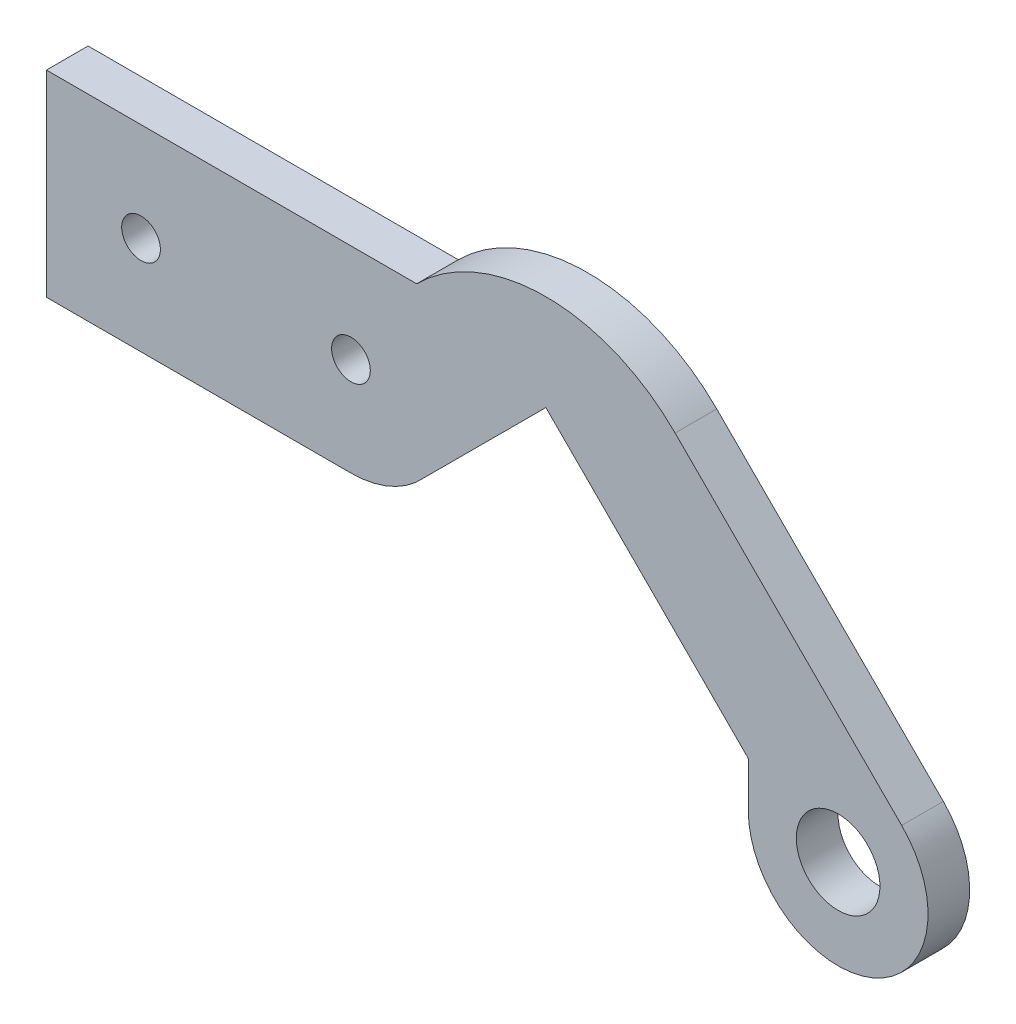
from build123d import *

# Parameters (mm, degrees)
SKETCH1_R            = 3.175
SKETCH1_R_2          = 4.8
BOSS_EXTRUDE1_DEPTH  = 3.175
SKETCH2_W            = 15
SKETCH2_H            = 3.175
CUT_EXTRUDE1_DEPTH   = 46.731068487
CUT_EXTRUDE2_START   = -10
CUT_EXTRUDE2_DEPTH   = 10
SKETCH4_W            = 11.581741037
SKETCH4_H            = 5.573186054
BOSS_EXTRUDE2_DEPTH  = 3.175
SKETCH5_R            = 1.475
CUT_EXTRUDE3_DEPTH   = 16
SKETCH6_W            = 21.273258962
SKETCH6_H            = 7.408259511
BOSS_EXTRUDE4_DEPTH  = 3.175
SKETCH12_R           = 4.8
CUT_EXTRUDE5_DEPTH   = 10
SKETCH15_R           = 4.85
BOSS_EXTRUDE10_DEPTH = 3.175
BOSS_EXTRUDE11_DEPTH = 3.175
BOSS_EXTRUDE12_DEPTH = 3.175
CUT_EXTRUDE6_DEPTH   = 10
CUT_EXTRUDE7_DEPTH   = 10
BOSS_EXTRUDE13_DEPTH = 3.175
BOSS_EXTRUDE14_DEPTH = 3.175
CUT_EXTRUDE8_DEPTH   = 10
SKETCH8_W            = 10
SKETCH8_H            = 3.175
CUT_EXTRUDE4_DEPTH   = 10
BOSS_EXTRUDE15_DEPTH = 3.175
CUT_EXTRUDE10_DEPTH  = 10
CUT_EXTRUDE11_DEPTH  = 10
BOSS_EXTRUDE16_DEPTH = 3.175
CUT_EXTRUDE12_DEPTH  = 3.175
BOSS_EXTRUDE18_DEPTH = 3.175
CUT_EXTRUDE13_DEPTH  = 3.175
BOSS_EXTRUDE19_DEPTH = 3.175
SKETCH32_R           = 6.716159248
SKETCH32_R_2         = 3.1875
BOSS_EXTRUDE20_DEPTH = 3.175


with BuildPart() as part:
    # Sketch1 → Boss-Extrude1 (new body)
    with BuildSketch(Plane.XY):
        with BuildLine():
            Line((-37.5, 7.5), (37.5, 7.5))
            ThreePointArc((37.5, 7.5), (45, 0), (37.5, -7.5))
            Line((37.5, -7.5), (-37.5, -7.5))
            ThreePointArc((-37.5, -7.5), (-45, 0), (-37.5, 7.5))
        make_face()
        with Locations((-37.5, 0)):
            Circle(SKETCH1_R, mode=Mode.SUBTRACT)
        with Locations((37.5, 0)):
            Circle(SKETCH1_R_2, mode=Mode.SUBTRACT)
    extrude(amount=BOSS_EXTRUDE1_DEPTH)

    # Sketch2 → Cut-Extrude1 (cut, through all)
    with BuildSketch(Plane.XY.offset(3.175)):
        with Locations((-17.5, 0.21703664)):
            Rectangle(SKETCH2_W, SKETCH2_H)
        with Locations((17.5, 0.853492694)):
            Rectangle(SKETCH2_W, SKETCH2_H)
    extrude(amount=-CUT_EXTRUDE1_DEPTH, mode=Mode.SUBTRACT)

    # Sketch3 → Cut-Extrude2 (cut)
    with BuildSketch(Plane.XY.offset(3.175).offset(CUT_EXTRUDE2_START)):
        with BuildLine():
            Line((-56.505330914, 0), (-45, 0))
            ThreePointArc((-45, 0), (-42.803300859, 5.303300859), (-37.5, 7.5))
            Line((-37.5, 7.5), (-20.71, 7.5))
            Line((-20.71, 7.5), (-20.71, 17.128469338))
            Line((-20.71, 17.128469338), (-56.505330914, 17.128469338))
            Line((-56.505330914, 17.128469338), (-56.505330914, 0))
        make_face()
        with BuildLine():
            ThreePointArc((-37.5, -7.5), (-42.803300859, -5.303300859), (-45, 0))
            Line((-45, 0), (-56.505330914, 0))
            Line((-56.505330914, 0), (-56.505330914, -10.2398458))
            Line((-56.505330914, -10.2398458), (-20.71, -10.2398458))
            Line((-20.71, -10.2398458), (-20.71, -7.5))
            Line((-20.71, -7.5), (-37.5, -7.5))
        make_face()
        with BuildLine():
            ThreePointArc((-40.675, 0), (-37.5, 3.175), (-34.325, 0))
            Line((-34.325, 0), (-25, 0))
            Line((-25, 0), (-25, 1.80453664))
            Line((-25, 1.80453664), (-20.71, 1.80453664))
            Line((-20.71, 1.80453664), (-20.71, 7.5))
            Line((-20.71, 7.5), (-37.5, 7.5))
            ThreePointArc((-37.5, 7.5), (-42.803300859, 5.303300859), (-45, 0))
            Line((-45, 0), (-40.675, 0))
        make_face()
        with BuildLine():
            Line((-25, 0), (-34.325, 0))
            ThreePointArc((-34.325, 0), (-37.5, -3.175), (-40.675, 0))
            Line((-40.675, 0), (-45, 0))
            ThreePointArc((-45, 0), (-42.803300859, -5.303300859), (-37.5, -7.5))
            Line((-37.5, -7.5), (-20.71, -7.5))
            Line((-20.71, -7.5), (-20.71, -1.37046336))
            Line((-20.71, -1.37046336), (-25, -1.37046336))
            Line((-25, -1.37046336), (-25, 0))
        make_face()
    extrude(amount=CUT_EXTRUDE2_DEPTH, mode=Mode.SUBTRACT)

    # Sketch4 → Boss-Extrude2 (add)
    with BuildSketch(Plane.XY.offset(3.175)):
        with Locations((-14.919129482, -0.129821549)):
            Rectangle(SKETCH4_W, SKETCH4_H)
    extrude(amount=-BOSS_EXTRUDE2_DEPTH)

    # Sketch5 → Cut-Extrude3 (cut)
    with BuildSketch(Plane.XY.offset(3.175)):
        with Locations((-13.5, 0)):
            Circle(SKETCH5_R)
        with Locations((2.5, 0)):
            Circle(SKETCH5_R)
    extrude(amount=-CUT_EXTRUDE3_DEPTH, mode=Mode.SUBTRACT)

    # Sketch6 → Boss-Extrude4 (add)
    with BuildSketch(Plane.XY.offset(3.175)):
        with Locations((18.907585517, 0.667769414)):
            Rectangle(SKETCH6_W, SKETCH6_H)
    extrude(amount=-BOSS_EXTRUDE4_DEPTH)

    # Sketch12 → Cut-Extrude5 (cut)
    # profile 1 of 2: a face of its own
    with BuildSketch(Plane(origin=(0, 0, 0), x_dir=(-1, 0, 0), z_dir=(0, 0, -1))):
        with BuildLine():
            Line((-2.5, 7.5), (-37.5, 7.5))
            ThreePointArc((-37.5, 7.5), (-32.196699141, 5.303300859), (-30, 0))
            ThreePointArc((-30, 0), (-32.196699141, -5.303300859), (-37.5, -7.5))
            Line((-37.5, -7.5), (-2.5, -7.5))
            ThreePointArc((-2.5, -7.5), (-10, 0), (-2.5, 7.5))
        make_face()
    # profile 2 of 2: a face of its own
    with BuildSketch(Plane(origin=(0, 0, 0), x_dir=(-1, 0, 0), z_dir=(0, 0, -1))):
        with BuildLine():
            ThreePointArc((-30, 0), (-32.196699141, 5.303300859), (-37.5, 7.5))
            ThreePointArc((-37.5, 7.5), (-45, 0), (-37.5, -7.5))
            ThreePointArc((-37.5, -7.5), (-32.196699141, -5.303300859), (-30, 0))
        make_face()
        with Locations((-37.5, 0)):
            Circle(SKETCH12_R, mode=Mode.SUBTRACT)
    extrude(amount=-CUT_EXTRUDE5_DEPTH, mode=Mode.SUBTRACT)

    # Sketch15 → Boss-Extrude10 (add)
    with BuildSketch(Plane(origin=(0, 0, 0), x_dir=(-1, 0, 0), z_dir=(0, 0, -1))):
        with BuildLine():
            ThreePointArc((-46.001929081, -17.143138466), (-35.871769222, -20.337345998), (-34.79216247, -9.770532392))
            Line((-34.79216247, -9.770532392), (-34.739826286, -9.718196208))
            ThreePointArc((-34.739826286, -9.718196208), (-27.229011247, 7.510815039), (-10, 0))
            ThreePointArc((-10, 0), (-7.803300859, 5.303300859), (-2.5, 7.5))
            ThreePointArc((-2.5, 7.5), (-36.707777113, 17.168137065), (-46.001929081, -17.143138466))
        make_face()
        with Locations((-39.635843921, -14.614213843)):
            Circle(SKETCH15_R, mode=Mode.SUBTRACT)
    extrude(amount=-BOSS_EXTRUDE10_DEPTH)

    # Sketch16 → Boss-Extrude11 (add)
    with BuildSketch(Plane(origin=(0, 0, 0), x_dir=(-1, 0, 0), z_dir=(0, 0, -1))):
        with BuildLine():
            Line((-21.509690563, 8.403088845), (-7.803300859, -5.303300859))
            ThreePointArc((-7.803300859, -5.303300859), (-9.429096494, -2.870125743), (-10, 0))
            ThreePointArc((-10, 0), (-14.533325981, 5.874656467), (-21.509690563, 8.403088845))
        make_face()
    extrude(amount=-BOSS_EXTRUDE11_DEPTH)

    # Sketch17 → Boss-Extrude12 (add)
    with BuildSketch(Plane(origin=(0, 0, 0), x_dir=(-1, 0, 0), z_dir=(0, 0, -1))):
        with BuildLine():
            Line((-20.755882022, 9.519320843), (-23.45404322, 8.658356332))
            ThreePointArc((-23.45404322, 8.658356332), (-23.129421083, 8.546024811), (-22.808422976, 8.423721426))
            ThreePointArc((-22.808422976, 8.423721426), (-22.158804554, 8.429280981), (-21.509690563, 8.403088845))
            Line((-21.509690563, 8.403088845), (-19.064115898, 5.95751418))
            Line((-19.064115898, 5.95751418), (-20.755882022, 9.519320843))
        make_face()
        with BuildLine():
            ThreePointArc((-21.509690563, 8.403088845), (-22.158804554, 8.429280981), (-22.808422976, 8.423721426))
            ThreePointArc((-22.808422976, 8.423721426), (-20.81070119, 7.38126118), (-19.064115898, 5.95751418))
            Line((-19.064115898, 5.95751418), (-21.509690563, 8.403088845))
        make_face()
        with BuildLine():
            ThreePointArc((-23.45404322, 8.658356332), (-36.40040662, 3.921172604), (-34.79216247, -9.770532392))
            Line((-34.79216247, -9.770532392), (-34.739826286, -9.718196208))
            ThreePointArc((-34.739826286, -9.718196208), (-33.473796187, 2.443597762), (-22.808422976, 8.423721426))
            ThreePointArc((-22.808422976, 8.423721426), (-23.129421083, 8.546024811), (-23.45404322, 8.658356332))
        make_face()
        with BuildLine():
            ThreePointArc((-22.808422976, 8.423721426), (-33.473796187, 2.443597762), (-34.739826286, -9.718196208))
            Line((-34.739826286, -9.718196208), (-32.925869648, -7.90423957))
            Line((-32.925869648, -7.90423957), (-19.064115898, 5.95751418))
            ThreePointArc((-19.064115898, 5.95751418), (-20.81070119, 7.38126118), (-22.808422976, 8.423721426))
        make_face()
    extrude(amount=-BOSS_EXTRUDE12_DEPTH)

    # Sketch18 → Cut-Extrude6 (cut)
    with BuildSketch(Plane(origin=(0, 0, 0), x_dir=(-1, 0, 0), z_dir=(0, 0, -1))):
        Polygon((-49.385473713, -4.584123483), (-24.385473713, 20.415876517), (-30.56765092, 24.378047278), (-55.403941692, 2.136458495), align=None)
    extrude(amount=-CUT_EXTRUDE6_DEPTH, mode=Mode.SUBTRACT)

    # Sketch19 → Cut-Extrude7 (cut)
    with BuildSketch(Plane(origin=(0, 0, 0), x_dir=(-1, 0, 0), z_dir=(0, 0, -1))):
        with BuildLine():
            ThreePointArc((-46.001929081, -17.143138466), (-46.344312222, -13.228951032), (-44.479525373, -9.770532392))
            Line((-44.479525373, -9.770532392), (-15.809929944, 18.899063036))
            ThreePointArc((-15.809929944, 18.899063036), (-20.031146151, 20.033752776), (-24.385473713, 20.415876517))
            Line((-24.385473713, 20.415876517), (-49.385473713, -4.584123483))
            ThreePointArc((-49.385473713, -4.584123483), (-48.524771385, -11.08753089), (-46.001929081, -17.143138466))
        make_face()
    extrude(amount=-CUT_EXTRUDE7_DEPTH, mode=Mode.SUBTRACT)

    # Sketch20 → Boss-Extrude13 (add)
    with BuildSketch(Plane(origin=(0, 0, 0), x_dir=(-1, 0, 0), z_dir=(0, 0, -1))):
        with BuildLine():
            Line((-32.785843921, -14.614213843), (-32.785843921, -7.764213843))
            ThreePointArc((-32.785843921, -7.764213843), (-34.411726772, -8.208442505), (-35.585840533, -9.417694765))
            Line((-35.585840533, -9.417694765), (-32.785843921, -14.614213843))
        make_face()
        Polygon((-46.485843921, -14.614213843), (-46.485843921, -7.764213843), (-15.809929944, 18.899063036), align=None)
    extrude(amount=-BOSS_EXTRUDE13_DEPTH)

    # Sketch21 → Boss-Extrude14 (add)
    with BuildSketch(Plane(origin=(0, 0, 0), x_dir=(-1, 0, 0), z_dir=(0, 0, -1))):
        with BuildLine():
            Line((-15.809929944, 18.899063036), (-3.494683458, 5.188322232))
            Line((-3.494683458, 5.188322232), (20.71, 7.5))
            ThreePointArc((20.71, 7.5), (3.510589711, 16.597300494), (-15.809929944, 18.899063036))
        make_face()
    extrude(amount=-BOSS_EXTRUDE14_DEPTH)

    # Sketch22 → Cut-Extrude8 (cut)
    with BuildSketch(Plane(origin=(0, 0, 0), x_dir=(-1, 0, 0), z_dir=(0, 0, -1))):
        with BuildLine():
            ThreePointArc((-7.803300859, -5.303300859), (-9.665367717, 2.215289028), (-3.884823194, 7.371042309))
            Line((-3.884823194, 7.371042309), (-19.064115898, 5.95751418))
            Line((-19.064115898, 5.95751418), (-7.803300859, -5.303300859))
        make_face()
    extrude(amount=-CUT_EXTRUDE8_DEPTH, mode=Mode.SUBTRACT)

    # Sketch8 → Cut-Extrude4 (cut)
    with BuildSketch(Plane.XY.offset(3.175)):
        with Locations((19, 0)):
            Rectangle(SKETCH8_W, SKETCH8_H)
    extrude(amount=-CUT_EXTRUDE4_DEPTH, mode=Mode.SUBTRACT)

    # Sketch24 → Boss-Extrude15 (add)
    with BuildSketch(Plane(origin=(0, 0, 0), x_dir=(-1, 0, 0), z_dir=(0, 0, -1))):
        Polygon((-32.785843921, -7.764213843), (-19.064115898, 5.95751418), (-25.92497991, 1.835763138), align=None)
    extrude(amount=-BOSS_EXTRUDE15_DEPTH)

    # Sketch25 → Cut-Extrude10 (cut)
    with BuildSketch(Plane(origin=(0, 0, 0), x_dir=(-1, 0, 0), z_dir=(0, 0, -1))):
        with BuildLine():
            ThreePointArc((-46.485843921, -14.614213843), (-45.964418719, -11.992832332), (-44.479525373, -9.770532392))
            Line((-44.479525373, -9.770532392), (-15.809929944, 18.899063036))
            Line((-15.809929944, 18.899063036), (-46.485843921, -7.764213843))
            Line((-46.485843921, -7.764213843), (-46.485843921, -14.614213843))
        make_face()
    extrude(amount=-CUT_EXTRUDE10_DEPTH, mode=Mode.SUBTRACT)

    # Sketch26 → Cut-Extrude11 (cut)
    with BuildSketch(Plane(origin=(0, 0, 0), x_dir=(-1, 0, 0), z_dir=(0, 0, -1))):
        with BuildLine():
            Line((-15.809929944, 18.899063036), (-23.907797349, 10.801195631))
            ThreePointArc((-23.907797349, 10.801195631), (-1.26089762, 15.105031891), (20.545662044, 7.629804166))
            ThreePointArc((20.545662044, 7.629804166), (3.410605692, 16.628400783), (-15.809929944, 18.899063036))
        make_face()
        with BuildLine():
            Line((-24.462923893, 21.153371093), (-23.907797349, 10.801195631))
            Line((-23.907797349, 10.801195631), (-15.809929944, 18.899063036))
            ThreePointArc((-15.809929944, 18.899063036), (3.410605692, 16.628400783), (20.545662044, 7.629804166))
            Line((20.545662044, 7.629804166), (12.510465987, 32.510755223))
            Line((12.510465987, 32.510755223), (-24.462923893, 21.153371093))
        make_face()
    extrude(amount=-CUT_EXTRUDE11_DEPTH, mode=Mode.SUBTRACT)

    # Sketch27 → Boss-Extrude16 (add)
    with BuildSketch(Plane(origin=(0, 0, 0), x_dir=(-1, 0, 0), z_dir=(0, 0, -1))):
        with BuildLine():
            ThreePointArc((-8.038695105, -5.056961196), (-9.359104011, -3.033593935), (-9.967690986, -0.69540732))
            ThreePointArc((-9.967690986, -0.69540732), (-8.488209602, 4.515677775), (-3.884823194, 7.371042309))
            Line((-3.884823194, 7.371042309), (-19.064115898, 5.95751418))
            Line((-19.064115898, 5.95751418), (-8.038695105, -5.056961196))
        make_face()
    extrude(amount=-BOSS_EXTRUDE16_DEPTH)

    # Sketch28 → Cut-Extrude12 (cut)
    with BuildSketch(Plane(origin=(0, 0, 0), x_dir=(-1, 0, 0), z_dir=(0, 0, -1))):
        Polygon((20.71, 7.5), (-23.907797349, 10.801195631), (-10.730396659, 19.898602306), (15.158212603, 17.043524683), align=None)
    extrude(amount=-CUT_EXTRUDE12_DEPTH, mode=Mode.SUBTRACT)

    # Sketch29 → Boss-Extrude18 (add)
    with BuildSketch(Plane(origin=(0, 0, 0), x_dir=(-1, 0, 0), z_dir=(0, 0, -1))):
        Polygon((-19.064115898, 5.95751418), (-32.785843921, -7.764213843), (-32.785843921, -11.189213843), (-17.358434587, 4.253526174), align=None)
    extrude(amount=-BOSS_EXTRUDE18_DEPTH)

    # Sketch30 → Cut-Extrude13 (cut)
    with BuildSketch(Plane(origin=(0, 0, 0), x_dir=(-1, 0, 0), z_dir=(0, 0, -1))):
        Polygon((20.71, 7.5), (-29.726171722, 7.5), (-24.020649075, 17.421001934), align=None)
    extrude(amount=-CUT_EXTRUDE13_DEPTH, mode=Mode.SUBTRACT)

    # Sketch31 → Boss-Extrude19 (add)
    with BuildSketch(Plane(origin=(0, 0, 0), x_dir=(-1, 0, 0), z_dir=(0, 0, -1))):
        with BuildLine():
            Line((-27.20899298, 7.5), (-7.507876194, 7.5))
            ThreePointArc((-7.507876194, 7.5), (-17.358434587, 11.580234883), (-27.20899298, 7.5))
        make_face()
    extrude(amount=-BOSS_EXTRUDE19_DEPTH)

    # Sketch32 → Boss-Extrude20 (add)
    with BuildSketch(Plane(origin=(0, 0, 0), x_dir=(-1, 0, 0), z_dir=(0, 0, -1))):
        with Locations((-39.635843921, -14.614213843)):
            Circle(SKETCH32_R)
        with Locations((-39.635843921, -14.614213843)):
            Circle(SKETCH32_R_2, mode=Mode.SUBTRACT)
    extrude(amount=-BOSS_EXTRUDE20_DEPTH)


solid = part.part
